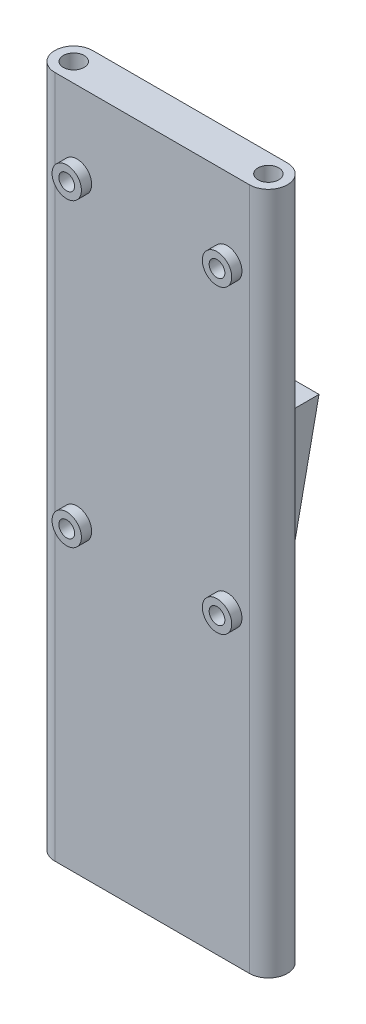
from build123d import *

# Parameters (mm, degrees)
SKETCH1_R                = 3.05
BOSS_EXTRUDE1_DEPTH      = 100
BOSS_EXTRUDE2_DEPTH      = 28.5
BOSS_EXTRUDE2_DEPTH_BACK = 28.5
SKETCH3_R                = 2.5
SKETCH3_R_2              = 1.5
BOSS_EXTRUDE3_DEPTH      = 1.5
CHAMFER1_SIZE            = 0.5
SKETCH4_R                = 4.3
SKETCH4_R_2              = 2.3
BOSS_EXTRUDE4_DEPTH      = 3
CUT_EXTRUDE1_START       = -3
SKETCH4_2_R              = 2.3
CUT_EXTRUDE1_DEPTH       = 3


with BuildPart() as part:
    # Sketch1 → Boss-Extrude1 (new, symmetric)
    with BuildSketch(Plane(origin=(0, 0, 0), x_dir=(1, 0, 0), z_dir=(0, 1, 0))):
        with BuildLine():
            Line((-28.5, 5.55), (28.5, 5.55))
            ThreePointArc((28.5, 5.55), (34.05, 0), (28.5, -5.55))
            Line((28.5, -5.55), (-28.5, -5.55))
            ThreePointArc((-28.5, -5.55), (-34.05, 0), (-28.5, 5.55))
        make_face()
        with Locations(Location((-28.5, 0, 0), (0, 0, 270))):
            Circle(SKETCH1_R, mode=Mode.SUBTRACT)
        with Locations(Location((28.5, 0, 0), (0, 0, 270))):
            Circle(SKETCH1_R, mode=Mode.SUBTRACT)
    extrude(amount=BOSS_EXTRUDE1_DEPTH, both=True)

    # Sketch2 → Boss-Extrude2 (add, two sides: drawn at the far end of the back side and taken through both)
    with BuildSketch(Plane(origin=(0, 0, 0), x_dir=(0, 0, -1), z_dir=(1, 0, 0)).offset(-BOSS_EXTRUDE2_DEPTH_BACK)):
        Polygon((5.55, 36.664900987), (5.55, -0.532059786), (7.05, -0.532059786), (14.82084997, 36.664900987), align=None)
    extrude(amount=BOSS_EXTRUDE2_DEPTH + BOSS_EXTRUDE2_DEPTH_BACK)

    # Sketch3 → Boss-Extrude3 (add)
    # profile 1 of 4: a face of its own
    with BuildSketch(Plane(origin=(0, -1.433480354, -6.861683432), x_dir=(-1, 0, 0), z_dir=(0, -0.20449605184178382, -0.9788673887616864))):
        with Locations(Location((-14, 33.920881193, 0), (0, 0, 270))):
            Circle(SKETCH3_R)
        with Locations(Location((-14, 33.920881193, 0), (0, 0, 270))):
            Circle(SKETCH3_R_2, mode=Mode.SUBTRACT)
    # profile 2 of 4: a face of its own
    with BuildSketch(Plane(origin=(0, -1.433480354, -6.861683432), x_dir=(-1, 0, 0), z_dir=(0, -0.20449605184178382, -0.9788673887616864))):
        with Locations(Location((14, 33.920881193, 0), (0, 0, 270))):
            Circle(SKETCH3_R)
        with Locations(Location((14, 33.920881193, 0), (0, 0, 270))):
            Circle(SKETCH3_R_2, mode=Mode.SUBTRACT)
    # profile 3 of 4: a face of its own
    with BuildSketch(Plane(origin=(0, -1.433480354, -6.861683432), x_dir=(-1, 0, 0), z_dir=(0, -0.20449605184178382, -0.9788673887616864))):
        with Locations(Location((14, 5.920881193, 0), (0, 0, 270))):
            Circle(SKETCH3_R)
        with Locations(Location((14, 5.920881193, 0), (0, 0, 270))):
            Circle(SKETCH3_R_2, mode=Mode.SUBTRACT)
    # profile 4 of 4: a face of its own
    with BuildSketch(Plane(origin=(0, -1.433480354, -6.861683432), x_dir=(-1, 0, 0), z_dir=(0, -0.20449605184178382, -0.9788673887616864))):
        with Locations(Location((-14, 5.920881193, 0), (0, 0, 270))):
            Circle(SKETCH3_R)
        with Locations(Location((-14, 5.920881193, 0), (0, 0, 270))):
            Circle(SKETCH3_R_2, mode=Mode.SUBTRACT)
    extrude(amount=BOSS_EXTRUDE3_DEPTH)

    # Chamfer1
    chamfer1_edges = [part.edges().sort_by_distance(p)[0] for p in [
        (14, 33.910988438, -15.777910924),
        (-14, 33.910988438, -15.777910924),
        (-14, 6.502701552, -10.052021472),
        (14, 6.502701552, -10.052021472),
    ]]
    chamfer(chamfer1_edges, length=CHAMFER1_SIZE)

    # Sketch4 → Boss-Extrude4 (add)
    # profile 1 of 4: a face of its own
    with BuildSketch(Plane.XY.offset(5.55)):
        with Locations(Location((-22, 77, 0), (0, 0, 180))):
            Circle(SKETCH4_R)
        with Locations((-22, 77)):
            Circle(SKETCH4_R_2, mode=Mode.SUBTRACT)
    # profile 2 of 4: a face of its own
    with BuildSketch(Plane.XY.offset(5.55)):
        with Locations(Location((22, 77, 0), (0, 0, 180))):
            Circle(SKETCH4_R)
        with Locations((22, 77)):
            Circle(SKETCH4_R_2, mode=Mode.SUBTRACT)
    # profile 3 of 4: a face of its own
    with BuildSketch(Plane.XY.offset(5.55)):
        with Locations(Location((-22, -11, 0), (0, 0, 180))):
            Circle(SKETCH4_R)
        with Locations((-22, -11)):
            Circle(SKETCH4_R_2, mode=Mode.SUBTRACT)
    # profile 4 of 4: a face of its own
    with BuildSketch(Plane.XY.offset(5.55)):
        with Locations(Location((22, -11, 0), (0, 0, 180))):
            Circle(SKETCH4_R)
        with Locations((22, -11)):
            Circle(SKETCH4_R_2, mode=Mode.SUBTRACT)
    extrude(amount=BOSS_EXTRUDE4_DEPTH)

    # Sketch4<2> → Cut-Extrude1 (cut)
    with BuildSketch(Plane.XY.offset(5.55).offset(CUT_EXTRUDE1_START)):
        with Locations((22, 77)):
            Circle(SKETCH4_2_R)
        with Locations((-22, 77)):
            Circle(SKETCH4_2_R)
        with Locations((22, -11)):
            Circle(SKETCH4_2_R)
        with Locations((-22, -11)):
            Circle(SKETCH4_2_R)
    extrude(amount=CUT_EXTRUDE1_DEPTH, mode=Mode.SUBTRACT)


solid = part.part
